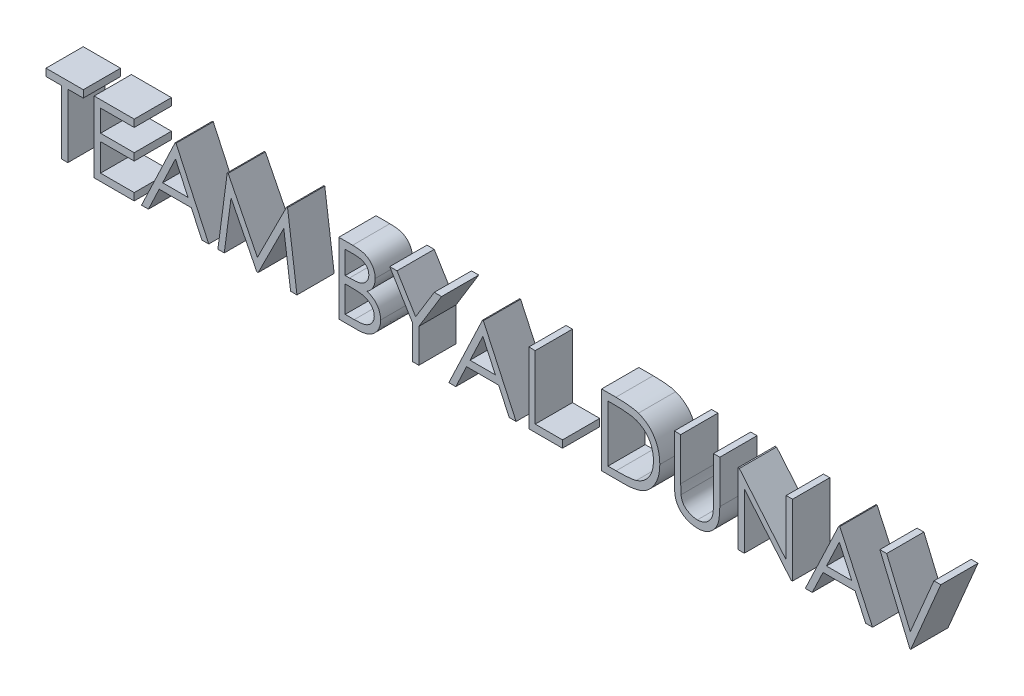
from build123d import *

# Parameters (mm, degrees)
BOSS_EXTRUDE3_DEPTH    = 10
BOSS_EXTRUDE3_2_DEPTH  = 10
BOSS_EXTRUDE3_3_DEPTH  = 10
BOSS_EXTRUDE3_4_DEPTH  = 10
BOSS_EXTRUDE3_5_DEPTH  = 10
BOSS_EXTRUDE3_6_DEPTH  = 10
BOSS_EXTRUDE3_7_DEPTH  = 10
BOSS_EXTRUDE3_8_DEPTH  = 10
BOSS_EXTRUDE3_9_DEPTH  = 10
BOSS_EXTRUDE3_10_DEPTH = 10
BOSS_EXTRUDE3_11_DEPTH = 10
BOSS_EXTRUDE3_12_DEPTH = 10
BOSS_EXTRUDE3_13_DEPTH = 10


with BuildPart() as part:
    # Sketch1 → Boss-Extrude3 (new body)
    with BuildSketch(Plane.XY):
        Polygon((-116.895254618, -4.143812807), (-116.895254618, -2.189966653), (-106.881793079, -2.189966653), (-106.881793079, -4.143812807), (-111.033716156, -4.143812807), (-111.033716156, -21.239966653), (-112.743331541, -21.239966653), (-112.743331541, -4.143812807), align=None)
    extrude(amount=BOSS_EXTRUDE3_DEPTH)


with BuildPart() as body_2:
    # Sketch1 → Boss-Extrude3 2 (new body)
    with BuildSketch(Plane.XY):
        Polygon((-103.951023848, -2.189966653), (-93.204870002, -2.189966653), (-93.204870002, -4.143812807), (-102.241408464, -4.143812807), (-102.241408464, -10.005351269), (-93.204870002, -10.005351269), (-93.204870002, -11.959197423), (-102.241408464, -11.959197423), (-102.241408464, -19.286120499), (-93.204870002, -19.286120499), (-93.204870002, -21.239966653), (-103.951023848, -21.239966653), align=None)
    extrude(amount=BOSS_EXTRUDE3_2_DEPTH)


with BuildPart() as body_3:
    # Sketch1 → Boss-Extrude3 3 (new body)
    with BuildSketch(Plane.XY):
        Polygon((-81.970254618, -2.189966653), (-73.177946925, -21.239966653), (-75.036390435, -21.239966653), (-77.852676493, -15.134197423), (-86.488523848, -15.134197423), (-89.384948127, -21.239966653), (-91.251023848, -21.239966653), (-82.214485387, -2.189966653), align=None)
        Polygon((-82.111450531, -5.903037567), (-85.561210146, -13.180351269), (-78.753277454, -13.180351269), align=None, mode=Mode.SUBTRACT)
    extrude(amount=BOSS_EXTRUDE3_3_DEPTH)


with BuildPart() as body_4:
    # Sketch1 → Boss-Extrude3 4 (new body)
    with BuildSketch(Plane.XY):
        Polygon((-70.735639233, -21.239966653), (-68.220825531, -2.189966653), (-67.976594762, -2.189966653), (-60.111600771, -17.820735884), (-52.26568731, -2.189966653), (-52.017640435, -2.189966653), (-49.48756231, -21.239966653), (-51.204809906, -21.239966653), (-53.028908464, -7.53251473), (-59.90553106, -21.239966653), (-60.290957743, -21.239966653), (-67.194293079, -7.501985884), (-69.014575531, -21.239966653), align=None)
    extrude(amount=BOSS_EXTRUDE3_4_DEPTH)


with BuildPart() as body_5:
    # Sketch1 → Boss-Extrude3 5 (new body)
    with BuildSketch(Plane.XY):
        with BuildLine():
            Line((-38.252946925, -2.189966653), (-34.536059906, -2.189966653))
            add(Edge.make_bspline(
                [(-34.536059906, -2.189966653), (-34.354113475, -2.190923238), (-34.001456008, -2.192777336), (-33.488633046, -2.221532664), (-33.008307377, -2.26074121), (-32.560339702, -2.322953572), (-32.144937022, -2.398020244), (-31.760847453, -2.488925843), (-31.409292373, -2.597927841), (-30.989578765, -2.7712626), (-30.511039168, -3.028835845), (-29.992887916, -3.409447035), (-29.54981627, -3.874988013), (-29.167802172, -4.400129323), (-28.86408465, -4.977811167), (-28.644360331, -5.594264751), (-28.505252467, -6.241538804), (-28.490946275, -6.685910958), (-28.483716156, -6.91048949)],
                knots=[0, 0, 0, 0, 1.001505555, 1.941167018, 2.826882275, 3.653841531, 4.429895133, 5.150066043, 5.825578002, 6.45369114, 7.647487171, 8.808567382, 9.977351308, 11.170798116, 12.373658725, 13.556498008, 14.765093433, 16, 16, 16, 16], degree=3))
            add(Edge.make_bspline(
                [(-28.483716156, -6.91048949), (-28.489666388, -7.120869829), (-28.501359154, -7.534287034), (-28.613170459, -8.1389564), (-28.788216383, -8.714545177), (-29.031540667, -9.258952732), (-29.347781532, -9.759878541), (-29.722567524, -10.221363517), (-30.174742692, -10.623868556), (-30.513523755, -10.848892069), (-30.685609185, -10.963193817)],
                knots=[0, 0, 0, 0, 1.044552857, 2.05264487, 3.044412934, 4.028983338, 5.005914585, 5.980388656, 6.974128949, 8, 8, 8, 8], degree=3))
            add(Edge.make_bspline(
                [(-30.685609185, -10.963193817), (-30.469198857, -11.046279025), (-30.055152292, -11.205241611), (-29.485361282, -11.486286065), (-28.994443626, -11.791968409), (-28.578624874, -12.125788907), (-28.223001352, -12.48560972), (-27.912470342, -12.876706842), (-27.647504576, -13.304182081), (-27.420467093, -13.763578467), (-27.243308863, -14.250205102), (-27.110634298, -14.759497469), (-27.034611468, -15.289629333), (-27.02379302, -15.650411184), (-27.018331541, -15.832544778)],
                knots=[0, 0, 0, 0, 1.27268992, 2.434971085, 3.483601985, 4.442670788, 5.356604649, 6.2567628, 7.179492994, 8.113709626, 9.066344395, 10.018646069, 10.999752585, 12, 12, 12, 12], degree=3))
            add(Edge.make_bspline(
                [(-27.018331541, -15.832544778), (-27.023648374, -16.018510182), (-27.034109393, -16.384402325), (-27.111288953, -16.921912414), (-27.241967093, -17.435581766), (-27.421968618, -17.928732832), (-27.65689493, -18.400411564), (-27.942797136, -18.85115233), (-28.28369179, -19.276426329), (-28.665033976, -19.680959192), (-29.096446511, -20.044693292), (-29.561896549, -20.368628781), (-30.067245804, -20.635035205), (-30.604194514, -20.858823836), (-31.178766006, -21.02976873), (-31.788380198, -21.149362311), (-32.432511326, -21.229944013), (-32.8745244, -21.236569085), (-33.101204137, -21.239966653)],
                knots=[0, 0, 0, 0, 0.978564426, 1.925352924, 2.850884081, 3.763762016, 4.682927383, 5.618979971, 6.567305752, 7.547517671, 8.540179244, 9.531824382, 10.526200242, 11.540722885, 12.589160233, 13.674978461, 14.80764778, 16, 16, 16, 16], degree=3))
            Line((-33.101204137, -21.239966653), (-38.252946925, -21.239966653))
            Line((-38.252946925, -21.239966653), (-38.252946925, -2.189966653))
        make_face()
        with BuildLine():
            Line((-36.543331541, -4.143812807), (-36.543331541, -10.249582038))
            Line((-36.543331541, -10.249582038), (-35.394683704, -10.249582038))
            add(Edge.make_bspline(
                [(-35.394683704, -10.249582038), (-35.226778118, -10.247405314), (-34.902350308, -10.24319944), (-34.432523443, -10.231151583), (-33.996414415, -10.197416518), (-33.594776009, -10.163691149), (-33.228240707, -10.108856608), (-32.897620547, -10.043585196), (-32.597726755, -9.974553955), (-32.251890086, -9.857154319), (-31.859607323, -9.683648687), (-31.441415713, -9.414380551), (-31.072746672, -9.093663714), (-30.76143055, -8.723598622), (-30.506642403, -8.316112668), (-30.329674897, -7.877707504), (-30.209674678, -7.419309357), (-30.198835058, -7.104612867), (-30.193331541, -6.944834442)],
                knots=[0, 0, 0, 0, 1.156816544, 2.235205308, 3.236616184, 4.169592532, 5.011045266, 5.787822928, 6.49130361, 7.128639758, 8.301311294, 9.436451833, 10.541879658, 11.654887649, 12.756523258, 13.837046038, 14.901820046, 16, 16, 16, 16], degree=3))
            add(Edge.make_bspline(
                [(-30.193331541, -6.944834442), (-30.196195464, -6.839102743), (-30.201813363, -6.631698469), (-30.247823481, -6.32935127), (-30.326024137, -6.044995988), (-30.426468218, -5.774735759), (-30.566832367, -5.52702126), (-30.73209636, -5.293287581), (-30.931771332, -5.081494478), (-31.159050419, -4.883540495), (-31.420354495, -4.708038136), (-31.715527669, -4.554327697), (-32.048563454, -4.430552898), (-32.413849136, -4.322152125), (-32.817007484, -4.24601584), (-33.253386125, -4.182588116), (-33.726559381, -4.150297049), (-34.053920582, -4.146022431), (-34.223139233, -4.143812807)],
                knots=[0, 0, 0, 0, 0.91205012, 1.789085906, 2.630437955, 3.453916878, 4.269457761, 5.079663411, 5.91843418, 6.774407191, 7.675494373, 8.627863946, 9.638891023, 10.736472738, 11.911756761, 13.175263542, 14.539845004, 16, 16, 16, 16], degree=3))
            Line((-34.223139233, -4.143812807), (-36.543331541, -4.143812807))
        make_face(mode=Mode.SUBTRACT)
        with BuildLine():
            Line((-36.543331541, -12.203428192), (-36.543331541, -19.286120499))
            Line((-36.543331541, -19.286120499), (-34.10865606, -19.286120499))
            add(Edge.make_bspline(
                [(-34.10865606, -19.286120499), (-33.93438162, -19.284031817), (-33.598490613, -19.280006158), (-33.113525346, -19.266864082), (-32.66403731, -19.23697041), (-32.252077599, -19.189912285), (-31.87319785, -19.138866726), (-31.531943209, -19.070225326), (-31.225547399, -18.991581698), (-30.870268667, -18.870019989), (-30.470199572, -18.681172054), (-30.039066197, -18.396433193), (-29.655746352, -18.057216333), (-29.33023487, -17.664618071), (-29.063464175, -17.237727563), (-28.869396627, -16.785179301), (-28.749703535, -16.314450931), (-28.735213728, -15.993503538), (-28.727946925, -15.832544778)],
                knots=[0, 0, 0, 0, 1.160039823, 2.235823828, 3.228722157, 4.157150951, 4.99529583, 5.772374946, 6.472645482, 7.099169577, 8.269452708, 9.405989375, 10.527446681, 11.663510218, 12.788923519, 13.866172445, 14.929861265, 16, 16, 16, 16], degree=3))
            add(Edge.make_bspline(
                [(-28.727946925, -15.832544778), (-28.729449722, -15.731888168), (-28.732431074, -15.532198547), (-28.777392421, -15.238742445), (-28.842782198, -14.954484478), (-28.927317574, -14.678652776), (-29.050432102, -14.416234256), (-29.194159154, -14.162038896), (-29.36267764, -13.915730673), (-29.625263743, -13.60433255), (-30.00719983, -13.245555666), (-30.549889565, -12.894287261), (-31.166958787, -12.610998482), (-31.614511284, -12.490714189), (-31.845705339, -12.428578432)],
                knots=[0, 0, 0, 0, 0.723448775, 1.435228256, 2.130040452, 2.821711965, 3.505591119, 4.210454504, 4.921174351, 5.648778258, 7.137944449, 8.670945889, 10.280296675, 12, 12, 12, 12], degree=3))
            add(Edge.make_bspline(
                [(-31.845705339, -12.428578432), (-31.938392275, -12.409772904), (-32.13935667, -12.368998639), (-32.467057929, -12.325958139), (-32.841177444, -12.287612885), (-33.262579105, -12.259249298), (-33.731796068, -12.229931111), (-34.24983044, -12.218529299), (-34.814566681, -12.204926183), (-35.20641088, -12.203940296), (-35.409948127, -12.203428192)],
                knots=[0, 0, 0, 0, 0.634451884, 1.375622551, 2.216452059, 3.157844607, 4.20941857, 5.370758133, 6.634282058, 8, 8, 8, 8], degree=3))
            Line((-35.409948127, -12.203428192), (-36.543331541, -12.203428192))
        make_face(mode=Mode.SUBTRACT)
    extrude(amount=BOSS_EXTRUDE3_5_DEPTH)


with BuildPart() as body_6:
    # Sketch1 → Boss-Extrude3 6 (new body)
    with BuildSketch(Plane.XY):
        Polygon((-24.576023848, -2.189966653), (-22.618361589, -2.189966653), (-17.611630819, -10.375513528), (-12.612532262, -2.189966653), (-10.654870002, -2.189966653), (-16.760639233, -12.184347663), (-16.760639233, -21.239966653), (-18.470254618, -21.239966653), (-18.470254618, -12.184347663), align=None)
    extrude(amount=BOSS_EXTRUDE3_6_DEPTH)


with BuildPart() as body_7:
    # Sketch1 → Boss-Extrude3 7 (new body)
    with BuildSketch(Plane.XY):
        Polygon((0.579745382, -2.189966653), (9.372053075, -21.239966653), (7.513609565, -21.239966653), (4.697323507, -15.134197423), (-3.938523848, -15.134197423), (-6.834948127, -21.239966653), (-8.701023848, -21.239966653), (0.335514613, -2.189966653), align=None)
        Polygon((0.438549469, -5.903037567), (-3.011210146, -13.180351269), (3.796722546, -13.180351269), align=None, mode=Mode.SUBTRACT)
    extrude(amount=BOSS_EXTRUDE3_7_DEPTH)


with BuildPart() as body_8:
    # Sketch1 → Boss-Extrude3 8 (new body)
    with BuildSketch(Plane.XY):
        Polygon((12.791283844, -2.189966653), (14.500899229, -2.189966653), (14.500899229, -19.286120499), (21.827822306, -19.286120499), (21.827822306, -21.239966653), (12.791283844, -21.239966653), align=None)
    extrude(amount=BOSS_EXTRUDE3_8_DEPTH)


with BuildPart() as body_9:
    # Sketch1 → Boss-Extrude3 9 (new body)
    with BuildSketch(Plane.XY):
        with BuildLine():
            Line((32.329745382, -21.239966653), (32.329745382, -2.189966653))
            Line((32.329745382, -2.189966653), (36.176379998, -2.189966653))
            add(Edge.make_bspline(
                [(36.176379998, -2.189966653), (36.510946919, -2.192375499), (37.157328471, -2.197029375), (38.091390506, -2.226537233), (38.955627842, -2.278736768), (39.747198118, -2.354770903), (40.468274429, -2.448132415), (41.11683771, -2.565156044), (41.696241516, -2.703340229), (42.052582329, -2.821153322), (42.221091536, -2.876865692)],
                knots=[0, 0, 0, 0, 1.314313732, 2.53924729, 3.670748893, 4.714932338, 5.66265055, 6.526160246, 7.303039223, 8, 8, 8, 8], degree=3))
            add(Edge.make_bspline(
                [(42.221091536, -2.876865692), (42.441498617, -2.960852818), (42.877314678, -3.126922522), (43.49783916, -3.440193248), (44.081995778, -3.795138844), (44.632917124, -4.192227183), (45.138018765, -4.642701708), (45.617033174, -5.127426703), (46.050364742, -5.664028954), (46.447194182, -6.24137996), (46.804983986, -6.852678416), (47.115984259, -7.496759508), (47.374269566, -8.170352311), (47.58868127, -8.871583617), (47.757662704, -9.60199533), (47.872952932, -10.362437944), (47.948995034, -11.149906104), (47.956637085, -11.684255685), (47.960514613, -11.955381317)],
                knots=[0, 0, 0, 0, 0.984719456, 1.947108742, 2.898477687, 3.838006223, 4.779231079, 5.722358779, 6.681677486, 7.655904652, 8.64651281, 9.637519902, 10.640069247, 11.656948941, 12.698408672, 13.768548281, 14.867775369, 16, 16, 16, 16], degree=3))
            add(Edge.make_bspline(
                [(47.960514613, -11.955381317), (47.957091233, -12.190846058), (47.950345105, -12.654853923), (47.889769829, -13.338699369), (47.80172443, -14.002257522), (47.665412438, -14.642368546), (47.499935901, -15.264640704), (47.287859592, -15.862441919), (47.044914963, -16.441256082), (46.761614909, -16.993256915), (46.450602514, -17.516224984), (46.116837026, -18.009214644), (45.760674441, -18.465191209), (45.378718496, -18.885535512), (44.975905068, -19.269613874), (44.549596926, -19.6206347), (44.098694035, -19.931729663), (43.625215958, -20.215123495), (43.11535017, -20.462340002), (42.559439241, -20.671509055), (41.955112401, -20.844845633), (41.303853006, -20.989467223), (40.604535792, -21.10418797), (39.856475135, -21.181075906), (39.060820373, -21.233071154), (38.514470372, -21.237623524), (38.233261007, -21.239966653)],
                knots=[0, 0, 0, 0, 1.105936401, 2.179363191, 3.223086493, 4.248585256, 5.251745608, 6.245858792, 7.225916811, 8.198733463, 9.158002045, 10.082870192, 10.993790845, 11.873723703, 12.748670949, 13.606408763, 14.465103618, 15.319838547, 16.196477973, 17.123216899, 18.106603292, 19.147568657, 20.255746949, 21.433717677, 22.679120308, 24, 24, 24, 24], degree=3))
            Line((38.233261007, -21.239966653), (32.329745382, -21.239966653))
        make_face()
        with BuildLine():
            Line((34.039360767, -19.286120499), (36.225989373, -19.286120499))
            add(Edge.make_bspline(
                [(36.225989373, -19.286120499), (36.540196648, -19.284770146), (37.144532308, -19.282172923), (38.013527979, -19.259382574), (38.807528694, -19.222142886), (39.526647195, -19.170027105), (40.170477456, -19.101073643), (40.740365009, -19.024193815), (41.234441772, -18.928413404), (41.53341485, -18.841594611), (41.671572306, -18.801475067)],
                knots=[0, 0, 0, 0, 1.375205317, 2.645023457, 3.804390687, 4.853969522, 5.800190428, 6.637939096, 7.370582563, 8, 8, 8, 8], degree=3))
            add(Edge.make_bspline(
                [(41.671572306, -18.801475067), (41.845462676, -18.740234443), (42.18909005, -18.619215925), (42.683742814, -18.39846637), (43.145063082, -18.136980247), (43.581090505, -17.846319299), (43.985639873, -17.516231773), (44.36350542, -17.153895391), (44.713926367, -16.757466116), (45.033282244, -16.327435979), (45.319077441, -15.86648152), (45.566570847, -15.37913444), (45.78347704, -14.870734515), (45.953721952, -14.333474666), (46.087156774, -13.772157934), (46.18167029, -13.18674483), (46.24053329, -12.577344682), (46.247399171, -12.162859548), (46.250899229, -11.951565211)],
                knots=[0, 0, 0, 0, 0.998632004, 1.973411704, 2.929992603, 3.868527914, 4.809262121, 5.754881198, 6.702106254, 7.672490631, 8.653608572, 9.636854334, 10.631411391, 11.644891563, 12.686317036, 13.754757253, 14.855430412, 16, 16, 16, 16], degree=3))
            add(Edge.make_bspline(
                [(46.250899229, -11.951565211), (46.248105479, -11.728770125), (46.242617133, -11.291087208), (46.173632672, -10.648880709), (46.072822491, -10.03122174), (45.927042714, -9.438068991), (45.741273216, -8.868265245), (45.509436666, -8.324961911), (45.24455121, -7.802421125), (44.929391619, -7.312703506), (44.584229604, -6.849553869), (44.201172861, -6.4252564), (43.786307194, -6.038844565), (43.344157513, -5.684300592), (42.86226273, -5.375888299), (42.351974785, -5.100007935), (41.805807632, -4.865878583), (41.425827101, -4.741352202), (41.232720142, -4.678067615)],
                knots=[0, 0, 0, 0, 1.122418816, 2.205001699, 3.251619955, 4.274784885, 5.280384055, 6.268708349, 7.249350384, 8.229342522, 9.199999885, 10.157847722, 11.105861043, 12.055065948, 13.010012805, 13.98527497, 14.976112212, 16, 16, 16, 16], degree=3))
            add(Edge.make_bspline(
                [(41.232720142, -4.678067615), (41.072966045, -4.633891057), (40.733285004, -4.539959576), (40.17898735, -4.437495762), (39.555153465, -4.347119846), (38.859013663, -4.270603946), (38.091361479, -4.215700097), (37.25160652, -4.174490514), (36.339385815, -4.146695843), (35.707020881, -4.144797879), (35.378813892, -4.143812807)],
                knots=[0, 0, 0, 0, 0.674548936, 1.434276114, 2.292660221, 3.240891867, 4.284742987, 5.42552168, 6.663806718, 8, 8, 8, 8], degree=3))
            Line((35.378813892, -4.143812807), (34.039360767, -4.143812807))
            Line((34.039360767, -4.143812807), (34.039360767, -19.286120499))
        make_face(mode=Mode.SUBTRACT)
    extrude(amount=BOSS_EXTRUDE3_9_DEPTH)


with BuildPart() as body_10:
    # Sketch1 → Boss-Extrude3 10 (new body)
    with BuildSketch(Plane.XY):
        with BuildLine():
            Line((51.868206921, -2.189966653), (53.577822306, -2.189966653))
            Line((53.577822306, -2.189966653), (53.577822306, -13.603939009))
            add(Edge.make_bspline(
                [(53.577822306, -13.603939009), (53.577567885, -13.765487014), (53.577085078, -14.072052192), (53.580310046, -14.508396799), (53.589341751, -14.896322612), (53.595035848, -15.237324946), (53.607703192, -15.529839043), (53.61803399, -15.775449663), (53.631317592, -15.972993822), (53.647282131, -16.088278577), (53.654144421, -16.13783324)],
                knots=[0, 0, 0, 0, 1.528628734, 2.90083645, 4.128790002, 5.200304208, 6.127813768, 6.898992206, 7.526736466, 8, 8, 8, 8], degree=3))
            add(Edge.make_bspline(
                [(53.654144421, -16.13783324), (53.68232459, -16.31661348), (53.737097075, -16.664100335), (53.876686646, -17.158901126), (54.071636187, -17.604842349), (54.302647605, -18.015839519), (54.607080818, -18.380453036), (54.971771489, -18.716340746), (55.413610486, -19.010101568), (55.904886068, -19.278710987), (56.434395718, -19.494602364), (56.97547704, -19.657851961), (57.519996683, -19.757341401), (57.884538382, -19.768861421), (58.06556269, -19.774582038)],
                knots=[0, 0, 0, 0, 1.035780045, 2.013197591, 2.933192213, 3.817615948, 4.702609284, 5.640816605, 6.646850145, 7.73207398, 8.84249596, 9.914020372, 10.964143139, 12, 12, 12, 12], degree=3))
            add(Edge.make_bspline(
                [(58.06556269, -19.774582038), (58.22097662, -19.768737224), (58.53090685, -19.757081355), (58.991407565, -19.68490128), (59.439899585, -19.554813916), (59.878597572, -19.386957516), (60.289810787, -19.165174199), (60.673768664, -18.908974344), (61.016472363, -18.608469433), (61.329208037, -18.275908987), (61.601541045, -17.900679504), (61.837603973, -17.490951353), (62.030966533, -17.040558479), (62.126453432, -16.724032266), (62.175508604, -16.56142098)],
                knots=[0, 0, 0, 0, 0.994687771, 1.983630487, 2.973142513, 3.978332533, 4.983357753, 5.956394766, 6.925816176, 7.893390482, 8.871859704, 9.88551698, 10.913711441, 12, 12, 12, 12], degree=3))
            add(Edge.make_bspline(
                [(62.175508604, -16.56142098), (62.191837857, -16.494209454), (62.228226014, -16.344435088), (62.262227788, -16.091226349), (62.297641876, -15.792471383), (62.322214036, -15.446023659), (62.34616925, -15.053044079), (62.360500689, -14.611485449), (62.367124825, -14.122951134), (62.369098842, -13.782026011), (62.370129998, -13.603939009)],
                knots=[0, 0, 0, 0, 0.558680831, 1.244966039, 2.062412453, 2.990489873, 4.051219941, 5.244515665, 6.560634259, 8, 8, 8, 8], degree=3))
            Line((62.370129998, -13.603939009), (62.370129998, -2.189966653))
            Line((62.370129998, -2.189966653), (64.079745382, -2.189966653))
            Line((64.079745382, -2.189966653), (64.079745382, -13.695525548))
            add(Edge.make_bspline(
                [(64.079745382, -13.695525548), (64.078362242, -13.902889582), (64.075662958, -14.307573102), (64.052255534, -14.900579784), (64.014933864, -15.463115297), (63.962202985, -15.995255257), (63.892333011, -16.495095466), (63.814635025, -16.967017133), (63.715686423, -17.407632707), (63.600116054, -17.820377723), (63.4679986, -18.213273161), (63.296868921, -18.586155763), (63.104058428, -18.950361281), (62.875378675, -19.300381131), (62.618413863, -19.637765084), (62.327484001, -19.96046705), (62.012211068, -20.273643859), (61.667354037, -20.569262119), (61.298597606, -20.840363632), (60.907038694, -21.078748643), (60.495685133, -21.280262904), (60.065606204, -21.446139007), (59.616618371, -21.570859896), (59.148710313, -21.66379753), (58.660816989, -21.71660575), (58.328995075, -21.724453969), (58.160965334, -21.728428192)],
                knots=[0, 0, 0, 0, 1.316592851, 2.569410997, 3.76748051, 4.895814652, 5.963796859, 6.97159953, 7.931736103, 8.829262218, 9.692595152, 10.560224239, 11.431080259, 12.30701507, 13.211635791, 14.121146779, 15.063487852, 16.031507147, 17.00238618, 17.966455255, 18.938106653, 19.907068911, 20.888905087, 21.893141452, 22.933117798, 24, 24, 24, 24], degree=3))
            add(Edge.make_bspline(
                [(58.160965334, -21.728428192), (57.977709219, -21.724156827), (57.618161375, -21.715776423), (57.088364181, -21.667755455), (56.580468341, -21.577303909), (56.089109639, -21.462133358), (55.620977676, -21.303290445), (55.1698005, -21.117699222), (54.743305393, -20.889767277), (54.334573335, -20.636166095), (53.954527163, -20.350826279), (53.605654154, -20.039820475), (53.287378344, -19.708130706), (53.00506444, -19.352165858), (52.754035054, -18.974694425), (52.537789178, -18.574648562), (52.352115664, -18.152183156), (52.256285634, -17.858523594), (52.207840334, -17.710068817)],
                knots=[0, 0, 0, 0, 1.13879206, 2.234305948, 3.301075583, 4.341971843, 5.366689343, 6.369221514, 7.369726634, 8.367512178, 9.355451585, 10.318319045, 11.268648973, 12.207971039, 13.137398894, 14.081662264, 15.030215811, 16, 16, 16, 16], degree=3))
            add(Edge.make_bspline(
                [(52.207840334, -17.710068817), (52.179661802, -17.608654376), (52.118541938, -17.388684195), (52.053089961, -17.024630593), (51.998067673, -16.605449398), (51.946330278, -16.131111918), (51.915801521, -15.601250502), (51.889036605, -15.016094831), (51.868018365, -14.374937354), (51.868142312, -13.928326347), (51.868206921, -13.695525548)],
                knots=[0, 0, 0, 0, 0.625038921, 1.35572334, 2.194682327, 3.136881307, 4.189498639, 5.346923369, 6.617055217, 8, 8, 8, 8], degree=3))
            Line((51.868206921, -13.695525548), (51.868206921, -2.189966653))
        make_face()
    extrude(amount=BOSS_EXTRUDE3_10_DEPTH)


with BuildPart() as body_11:
    # Sketch1 → Boss-Extrude3 11 (new body)
    with BuildSketch(Plane.XY):
        Polygon((68.964360767, -21.239966653), (68.964360767, -2.189966653), (69.323074709, -2.189966653), (81.908591536, -17.183446221), (81.908591536, -2.189966653), (83.618206921, -2.189966653), (83.618206921, -21.239966653), (83.228964132, -21.239966653), (70.673976152, -6.280832038), (70.673976152, -21.239966653), align=None)
    extrude(amount=BOSS_EXTRUDE3_11_DEPTH)


with BuildPart() as body_12:
    # Sketch1 → Boss-Extrude3 12 (new body)
    with BuildSketch(Plane.XY):
        Polygon((96.318206921, -2.189966653), (105.110514613, -21.239966653), (103.252071104, -21.239966653), (100.435785046, -15.134197423), (91.79993769, -15.134197423), (88.903513411, -21.239966653), (87.03743769, -21.239966653), (96.073976152, -2.189966653), align=None)
        Polygon((96.177011007, -5.903037567), (92.727251392, -13.180351269), (99.535184084, -13.180351269), align=None, mode=Mode.SUBTRACT)
    extrude(amount=BOSS_EXTRUDE3_12_DEPTH)


with BuildPart() as body_13:
    # Sketch1 → Boss-Extrude3 13 (new body)
    with BuildSketch(Plane.XY):
        Polygon((107.064360767, -2.189966653), (108.896091536, -2.189966653), (115.246091536, -17.202526749), (121.596091536, -2.189966653), (123.427822306, -2.189966653), (115.368206921, -21.239966653), (115.123976152, -21.239966653), align=None)
    extrude(amount=BOSS_EXTRUDE3_13_DEPTH)


solid = Compound([part.part, body_2.part, body_3.part, body_4.part, body_5.part, body_6.part, body_7.part, body_8.part, body_9.part, body_10.part, body_11.part, body_12.part, body_13.part])
